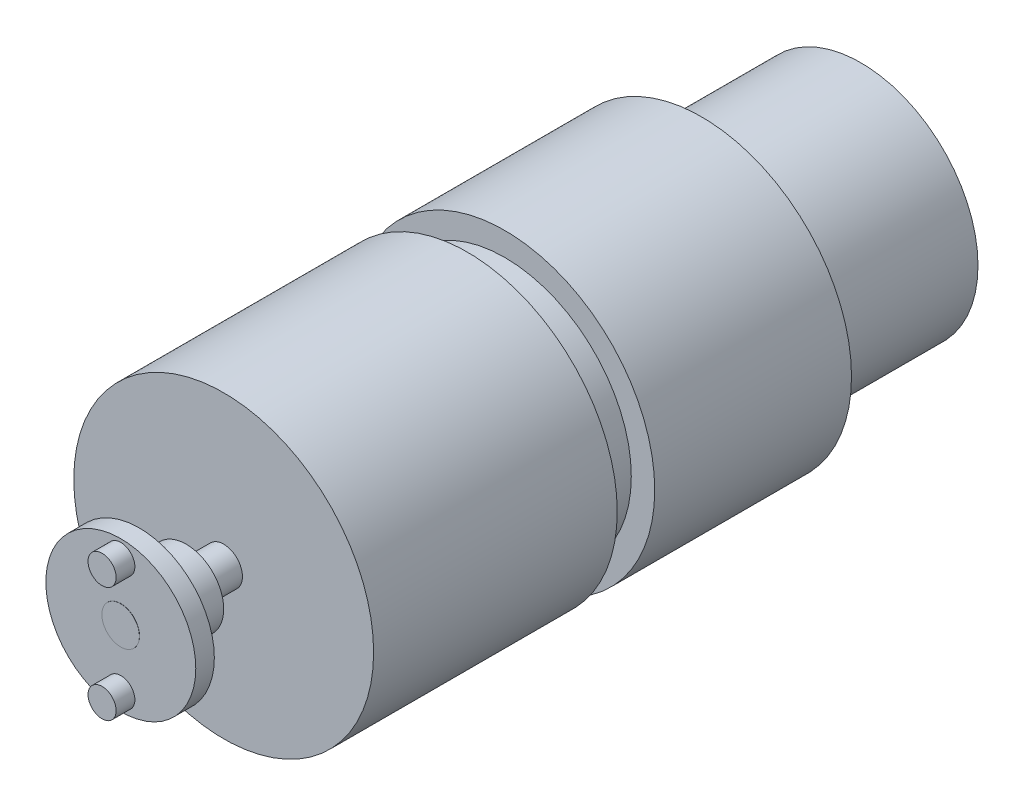
from build123d import *

# Parameters (mm, degrees)
SKETCH_1_R          = 12.5
EXTRUDE_1_DEPTH     = 17
SKETCH_2_R          = 16
EXTRUDE_2_DEPTH     = 51
SKETCH_3_R          = 2
EXTRUDE_3_DEPTH     = 11
SKETCH_4_R          = 4
EXTRUDE_4_DEPTH     = 5
SKETCH_5_R          = 8
EXTRUDE_5_DEPTH     = 1.98
SKETCH_6_R          = 1.5
EXTRUDE_6_DEPTH     = 2
SKETCH_7_R          = 20.782497367
SKETCH_7_R_2        = 13.5
CUT_EXTRUDE_8_DEPTH = 4


with BuildPart() as part:
    # Эскиз1 → Вытянуть1 (new body)
    with BuildSketch(Plane.XY):
        Circle(SKETCH_1_R)
    extrude(amount=EXTRUDE_1_DEPTH)

    # Эскиз2 → Вытянуть2 (add)
    with BuildSketch(Plane.XY.offset(17)):
        Circle(SKETCH_2_R)
    extrude(amount=EXTRUDE_2_DEPTH)

    # Эскиз3 → Вытянуть3 (add)
    with BuildSketch(Plane.XY.offset(68)):
        Circle(SKETCH_3_R)
    extrude(amount=EXTRUDE_3_DEPTH)

    # Эскиз4 → Вытянуть4 (add)
    with BuildSketch(Plane.XY.offset(72)):
        Circle(SKETCH_4_R)
    extrude(amount=EXTRUDE_4_DEPTH)

    # Эскиз5 → Вытянуть5 (add)
    with BuildSketch(Plane.XY.offset(77)):
        Circle(SKETCH_5_R)
    extrude(amount=EXTRUDE_5_DEPTH)

    # Эскиз6 → Вытянуть6 (add)
    with BuildSketch(Plane.XY.offset(78.98)):
        with Locations((0, -6.154904873)):
            Circle(SKETCH_6_R)
        with Locations(Location((0, 6.154904873, 0), (0, 0, 180))):
            Circle(SKETCH_6_R)
    extrude(amount=EXTRUDE_6_DEPTH)

    # Эскиз7 → Вытянуть8 (cut)
    with BuildSketch(Plane.XY.offset(38)):
        Circle(SKETCH_7_R)
        Circle(SKETCH_7_R_2, mode=Mode.SUBTRACT)
    extrude(amount=CUT_EXTRUDE_8_DEPTH, mode=Mode.SUBTRACT)


solid = part.part
